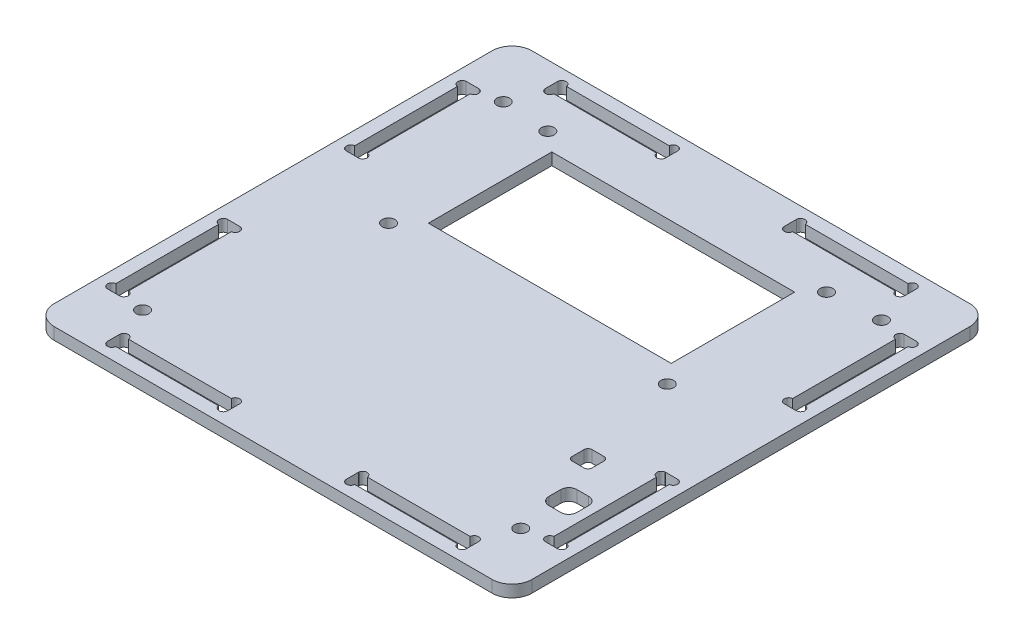
from build123d import *

# Parameters (mm, degrees)
SKETCH_1_W                         = 120
SKETCH_1_H                         = 120
SKETCH_1_R                         = 1.6
EXTRUDE_1_DEPTH                    = 3
SKETCH_2_R                         = 1.100315487
SKETCH_2_W                         = 30.2
SKETCH_2_H                         = 3.2
CUT_EXTRUDE_1_DEPTH                = 10
PATTERN_CIRCULAR_1_COUNT           = 4
PATTERN_CIRCULAR_1_COPY_1_SKETCH_R = 1.100315487
PATTERN_CIRCULAR_1_COPY_1_SKETCH_W = 30.2
PATTERN_CIRCULAR_1_COPY_1_SKETCH_H = 3.2
PATTERN_CIRCULAR_1_COPY_1_DEPTH    = 10
PATTERN_CIRCULAR_1_COPY_2_SKETCH_R = 1.100315487
PATTERN_CIRCULAR_1_COPY_2_SKETCH_W = 30.2
PATTERN_CIRCULAR_1_COPY_2_SKETCH_H = 3.2
PATTERN_CIRCULAR_1_COPY_2_DEPTH    = 10
PATTERN_CIRCULAR_1_COPY_3_SKETCH_R = 1.100315487
PATTERN_CIRCULAR_1_COPY_3_SKETCH_W = 30.2
PATTERN_CIRCULAR_1_COPY_3_SKETCH_H = 3.2
PATTERN_CIRCULAR_1_COPY_3_DEPTH    = 10
FILLET_1_R                         = 5
SKETCH_5_W                         = 7
SKETCH_5_H                         = 7
CUT_EXTRUDE_3_DEPTH                = 10
FILLET_2_R                         = 2
SKETCH_6_W                         = 5
SKETCH_6_H                         = 5
CUT_EXTRUDE_4_DEPTH                = 5
FILLET_3_R                         = 1
SKETCH_7_W                         = 61
SKETCH_7_H                         = 31
CUT_EXTRUDE_5_DEPTH                = 10
SKETCH_8_R                         = 1.6
CUT_EXTRUDE_6_DEPTH                = 10


with BuildPart() as part:
    # 草图1 → 凸台-拉伸1 (new body)
    with BuildSketch(Plane(origin=(0, 0, 0), x_dir=(1, 0, 0), z_dir=(0, 1, 0))):
        Rectangle(SKETCH_1_W, SKETCH_1_H)
        with Locations(Location((-47.5, 45.3, 0), (0, 0, 270))):
            Circle(SKETCH_1_R, mode=Mode.SUBTRACT)
        with Locations(Location((47.5, 45.3, 0), (0, 0, 270))):
            Circle(SKETCH_1_R, mode=Mode.SUBTRACT)
        with Locations(Location((47.5, -45.3, 0), (0, 0, 270))):
            Circle(SKETCH_1_R, mode=Mode.SUBTRACT)
        with Locations(Location((-47.5, -45.3, 0), (0, 0, 270))):
            Circle(SKETCH_1_R, mode=Mode.SUBTRACT)
    extrude(amount=EXTRUDE_1_DEPTH)

    # 草图2 → 切除-拉伸1 (cut)
    with BuildSketch(Plane(origin=(0, 3, 0), x_dir=(1, 0, 0), z_dir=(0, 1, 0))):
        with Locations((-16.000315487, 56.5)):
            Circle(SKETCH_2_R)
        with Locations((-16.000315487, 53.5)):
            Circle(SKETCH_2_R)
        with Locations((-43.999684513, 56.5)):
            Circle(SKETCH_2_R)
        with Locations((-43.999684513, 53.5)):
            Circle(SKETCH_2_R)
        with Locations((-30, 55)):
            Rectangle(SKETCH_2_W, SKETCH_2_H)
    cut_extrude_1 = extrude(amount=-CUT_EXTRUDE_1_DEPTH, mode=Mode.SUBTRACT)

    # 镜向1: 切除-拉伸1 across plane
    add(cut_extrude_1.mirror(Plane(origin=(0, 0, 0), x_dir=(0, 0, 1), z_dir=(1, 0, 0))), mode=Mode.SUBTRACT)

    # 阵列(圆周)1: 切除-拉伸1 ×4 about axis
    pattern_circular_1_axis = Axis((0, 0, 0), (0, 1, 0))
    for i in range(1, PATTERN_CIRCULAR_1_COUNT):
        add(cut_extrude_1.rotate(pattern_circular_1_axis, i * 360 / PATTERN_CIRCULAR_1_COUNT), mode=Mode.SUBTRACT)

    # 阵列(圆周)1 copy 1 sketch → 阵列(圆周)1 copy 1 (cut)
    with BuildSketch(Plane.ZX.offset(3)):
        with Locations((-16.000315487, -56.5)):
            Circle(PATTERN_CIRCULAR_1_COPY_1_SKETCH_R)
        with Locations((-16.000315487, -53.5)):
            Circle(PATTERN_CIRCULAR_1_COPY_1_SKETCH_R)
        with Locations((-43.999684513, -56.5)):
            Circle(PATTERN_CIRCULAR_1_COPY_1_SKETCH_R)
        with Locations((-43.999684513, -53.5)):
            Circle(PATTERN_CIRCULAR_1_COPY_1_SKETCH_R)
        with Locations((-30, -55)):
            Rectangle(PATTERN_CIRCULAR_1_COPY_1_SKETCH_W, PATTERN_CIRCULAR_1_COPY_1_SKETCH_H)
    extrude(amount=-PATTERN_CIRCULAR_1_COPY_1_DEPTH, mode=Mode.SUBTRACT)

    # 阵列(圆周)1 copy 2 sketch → 阵列(圆周)1 copy 2 (cut)
    with BuildSketch(Plane(origin=(0, 3, 0), x_dir=(1, 0, 0), z_dir=(0, 1, 0))):
        with Locations((-16.000315487, -56.5)):
            Circle(PATTERN_CIRCULAR_1_COPY_2_SKETCH_R)
        with Locations((-16.000315487, -53.5)):
            Circle(PATTERN_CIRCULAR_1_COPY_2_SKETCH_R)
        with Locations((-43.999684513, -56.5)):
            Circle(PATTERN_CIRCULAR_1_COPY_2_SKETCH_R)
        with Locations((-43.999684513, -53.5)):
            Circle(PATTERN_CIRCULAR_1_COPY_2_SKETCH_R)
        with Locations((-30, -55)):
            Rectangle(PATTERN_CIRCULAR_1_COPY_2_SKETCH_W, PATTERN_CIRCULAR_1_COPY_2_SKETCH_H)
    extrude(amount=-PATTERN_CIRCULAR_1_COPY_2_DEPTH, mode=Mode.SUBTRACT)

    # 阵列(圆周)1 copy 3 sketch → 阵列(圆周)1 copy 3 (cut)
    with BuildSketch(Plane(origin=(0, 3, 0), x_dir=(0, 0, -1), z_dir=(0, 1, 0))):
        with Locations((-16.000315487, -56.5)):
            Circle(PATTERN_CIRCULAR_1_COPY_3_SKETCH_R)
        with Locations((-16.000315487, -53.5)):
            Circle(PATTERN_CIRCULAR_1_COPY_3_SKETCH_R)
        with Locations((-43.999684513, -56.5)):
            Circle(PATTERN_CIRCULAR_1_COPY_3_SKETCH_R)
        with Locations((-43.999684513, -53.5)):
            Circle(PATTERN_CIRCULAR_1_COPY_3_SKETCH_R)
        with Locations((-30, -55)):
            Rectangle(PATTERN_CIRCULAR_1_COPY_3_SKETCH_W, PATTERN_CIRCULAR_1_COPY_3_SKETCH_H)
    extrude(amount=-PATTERN_CIRCULAR_1_COPY_3_DEPTH, mode=Mode.SUBTRACT)

    # 圆角1
    fillet_1_edges = [part.edges().sort_by_distance(p)[0] for p in [
        (60, 1.5, 60),
        (-60, 1.5, 60),
        (-60, 1.5, -60),
        (60, 1.5, -60),
    ]]
    fillet(fillet_1_edges, radius=FILLET_1_R)

    # 草图5 → 切除-拉伸3 (cut)
    with BuildSketch(Plane.XZ):
        with Locations((47.571001051, 33.3)):
            Rectangle(SKETCH_5_W, SKETCH_5_H)
    extrude(amount=-CUT_EXTRUDE_3_DEPTH, mode=Mode.SUBTRACT)

    # 圆角2
    fillet_2_edges = [part.edges().sort_by_distance(p)[0] for p in [
        (51.071001051, 1.5, 36.8),
        (51.071001051, 1.5, 29.8),
        (44.071001051, 1.5, 29.8),
        (44.071001051, 1.5, 36.8),
    ]]
    fillet(fillet_2_edges, radius=FILLET_2_R)

    # 草图6 → 切除-拉伸4 (cut)
    with BuildSketch(Plane.XZ):
        with Locations((40.8, 21.7)):
            Rectangle(SKETCH_6_W, SKETCH_6_H)
    extrude(amount=-CUT_EXTRUDE_4_DEPTH, mode=Mode.SUBTRACT)

    # 圆角3
    fillet_3_edges = [part.edges().sort_by_distance(p)[0] for p in [
        (38.3, 1.5, 19.2),
        (38.3, 1.5, 24.2),
        (43.3, 1.5, 24.2),
        (43.3, 1.5, 19.2),
    ]]
    fillet(fillet_3_edges, radius=FILLET_3_R)

    # 草图7 → 切除-拉伸5 (cut)
    with BuildSketch(Plane.XZ):
        with Locations((0, -25)):
            Rectangle(SKETCH_7_W, SKETCH_7_H)
    extrude(amount=-CUT_EXTRUDE_5_DEPTH, mode=Mode.SUBTRACT)

    # 草图8 → 切除-拉伸6 (cut)
    with BuildSketch(Plane.XZ):
        with Locations(Location((-35.5, -44.5, 0), (0, 0, 270))):
            Circle(SKETCH_8_R)
        with Locations(Location((34.5, -44.5, 0), (0, 0, 270))):
            Circle(SKETCH_8_R)
        with Locations(Location((34.5, -4.5, 0), (0, 0, 270))):
            Circle(SKETCH_8_R)
        with Locations(Location((-35.5, -4.5, 0), (0, 0, 270))):
            Circle(SKETCH_8_R)
    extrude(amount=-CUT_EXTRUDE_6_DEPTH, mode=Mode.SUBTRACT)


solid = part.part
